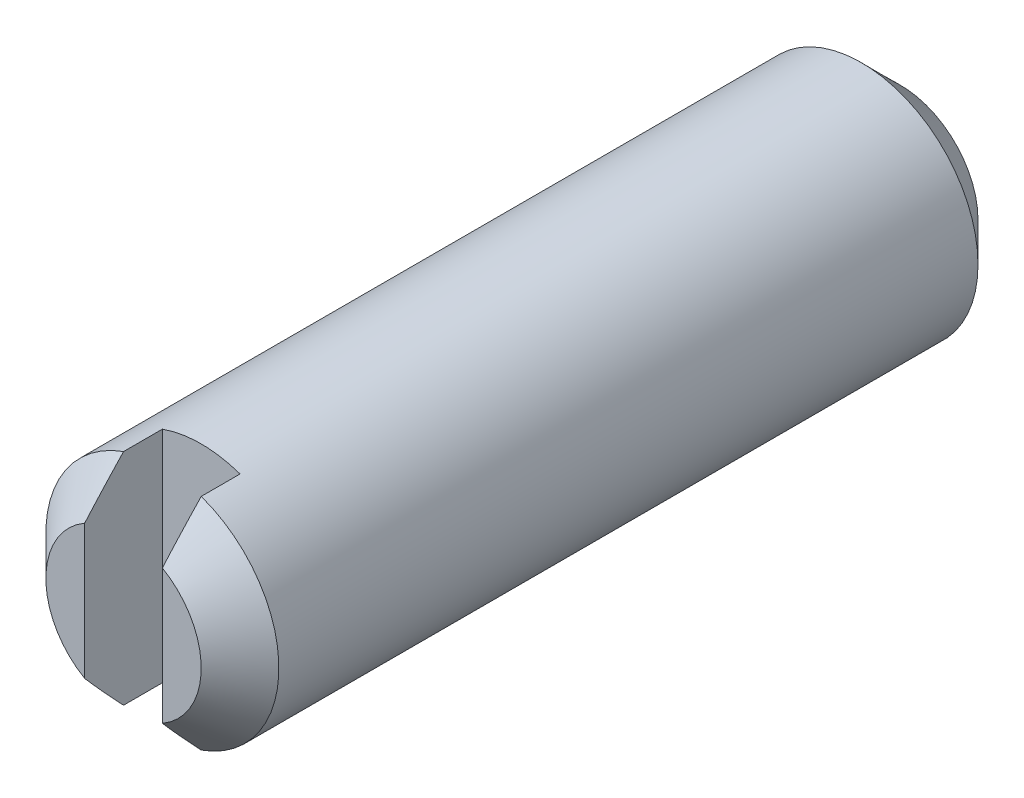
from build123d import *

# Parameters (mm, degrees)
SKETCH1_R           = 1.5
BOSS_EXTRUDE1_DEPTH = 10
CHAMFER1_SIZE       = 0.5
CUT_EXTRUDE1_START  = -1
CUT_EXTRUDE1_DEPTH  = 1


with BuildPart() as part:
    # Sketch1 → Boss-Extrude1 (new body)
    with BuildSketch(Plane.XY):
        Circle(SKETCH1_R)
    extrude(amount=BOSS_EXTRUDE1_DEPTH)

    # Chamfer1
    chamfer1_edges = [part.edges().sort_by_distance(p)[0] for p in [
        (-1.5, 0, 0),
        (-1.5, 0, 10),
    ]]
    chamfer(chamfer1_edges, length=CHAMFER1_SIZE)

    # Sketch2 → Cut-Extrude1 (cut)
    with BuildSketch(Plane.XY.offset(10).offset(CUT_EXTRUDE1_START)):
        with BuildLine():
            Line((-0.5, 1.414213562), (-0.5, -1.414213562))
            ThreePointArc((-0.5, -1.414213562), (0, -1.5), (0.5, -1.414213562))
            Line((0.5, -1.414213562), (0.5, 1.414213562))
            ThreePointArc((0.5, 1.414213562), (0, 1.5), (-0.5, 1.414213562))
        make_face()
    extrude(amount=CUT_EXTRUDE1_DEPTH, mode=Mode.SUBTRACT)


solid = part.part
